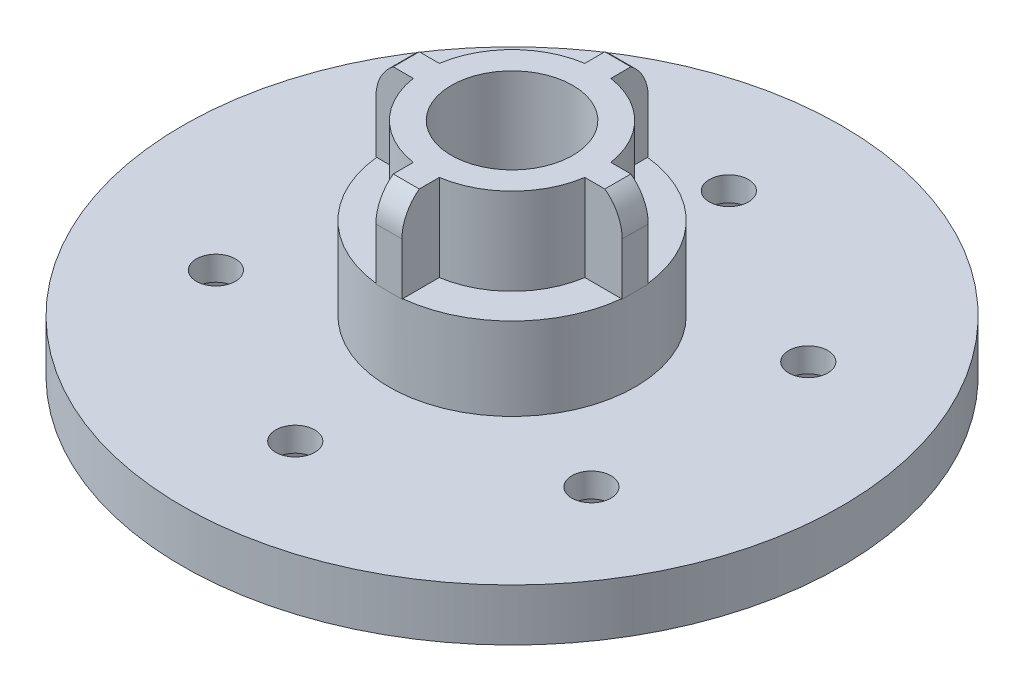
from build123d import *

# Parameters (mm, degrees)
BOSS_EXTRUDE1_DEPTH = 1.5
CIRPATTERN1_COUNT   = 4
SKETCH5_R           = 2.25
CUT_EXTRUDE1_DEPTH  = 58.177142505
CUT_EXTRUDE2_DEPTH  = 3.2
CIRPATTERN2_COUNT   = 6


with BuildPart() as part:
    # Sketch2 → Revolve1 (revolve)
    with BuildSketch(Plane.XY, mode=Mode.PRIVATE) as revolve1_sk:
        Polygon((7, 25.525), (10, 25.525), (10, 15.525), (14.2, 15.525), (14.2, 6), (38, 6), (38, 0), (11.2, 0), (11.2, 7), (7, 7), align=None)
    revolve(revolve1_sk.sketch.rotate(Axis((0, 0, 0), (0, 1, 0)), 90), axis=Axis((0, 0, 0), (0, 1, 0)))

    # Sketch4 → Boss-Extrude1 (add, symmetric)
    with BuildSketch(Plane.XY):
        with BuildLine():
            Line((-7, 25.525), (-12.2, 25.525))
            ThreePointArc((-12.2, 25.525), (-13.672135955, 23.761067977), (-14.2, 21.525))
            Line((-14.2, 21.525), (-14.2, 15.525))
            Line((-14.2, 15.525), (-7, 15.525))
            Line((-7, 15.525), (-7, 25.525))
        make_face()
    boss_extrude1 = extrude(amount=BOSS_EXTRUDE1_DEPTH, both=True)

    # CirPattern1: Boss-Extrude1 ×4 about axis
    cirpattern1_axis = Axis((0, 0, 0), (0, 1, 0))
    for i in range(1, CIRPATTERN1_COUNT):
        add(boss_extrude1.rotate(cirpattern1_axis, i * 360 / CIRPATTERN1_COUNT))

    # Sketch5 → Cut-Extrude1 (cut, through all)
    with BuildSketch(Plane(origin=(0, 6, 0), x_dir=(1, 0, 0), z_dir=(0, 1, 0))):
        with Locations(Location((0, 25, 0), (0, 0, 270))):
            Circle(SKETCH5_R)
    cut_extrude1 = extrude(amount=-CUT_EXTRUDE1_DEPTH, mode=Mode.SUBTRACT)

    # Sketch6 → Cut-Extrude2 (cut)
    with BuildSketch(Plane.XZ):
        Polygon((4.156921938, -25), (2.078460969, -21.4), (-2.078460969, -21.4), (-4.156921938, -25), (-2.078460969, -28.6), (2.078460969, -28.6), align=None)
    cut_extrude2 = extrude(amount=-CUT_EXTRUDE2_DEPTH, mode=Mode.SUBTRACT)

    # CirPattern2: Cut-Extrude1, Cut-Extrude2 ×6 about axis
    cirpattern2_axis = Axis((0, 0, 0), (0, 1, 0))
    add([cut_extrude1.rotate(cirpattern2_axis, i * 360 / CIRPATTERN2_COUNT) for i in range(1, CIRPATTERN2_COUNT)], mode=Mode.SUBTRACT)
    add([cut_extrude2.rotate(cirpattern2_axis, i * 360 / CIRPATTERN2_COUNT) for i in range(1, CIRPATTERN2_COUNT)], mode=Mode.SUBTRACT)


solid = part.part
